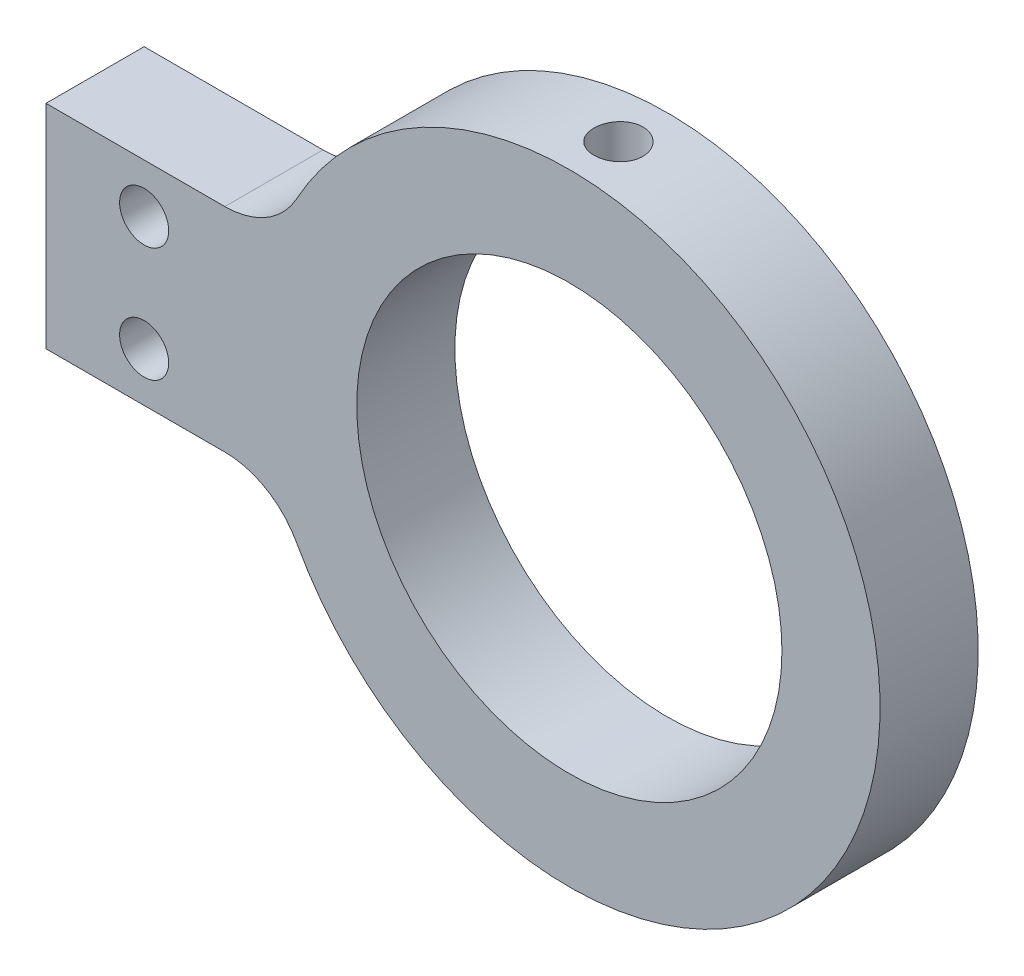
from build123d import *

# Parameters (mm, degrees)
SKETCH1_R               = 13
SKETCH1_R_2             = 1.5
BOSS_EXTRUDE1_DEPTH     = 3
CUT_EXTRUDE1_REACH      = 39.336
CUT_EXTRUDE1_END_RADIUS = 19
SKETCH2_R               = 1.5


with BuildPart() as part:
    # Sketch1 → Boss-Extrude1 (new, symmetric)
    with BuildSketch(Plane.XY):
        with BuildLine():
            Line((-21.065374433, 6.5), (-32, 6.5))
            Line((-32, 6.5), (-32, -6.5))
            Line((-32, -6.5), (-21.065374433, -6.5))
            ThreePointArc((-21.065374433, -6.5), (-18.513822618, -7.20004845), (-16.676754759, -9.104166667))
            ThreePointArc((-16.676754759, -9.104166667), (19, 0), (-16.676754759, 9.104166667))
            ThreePointArc((-16.676754759, 9.104166667), (-18.513822618, 7.20004845), (-21.065374433, 6.5))
        make_face()
        Circle(SKETCH1_R, mode=Mode.SUBTRACT)
        with Locations((-26, 3.5)):
            Circle(SKETCH1_R_2, mode=Mode.SUBTRACT)
        with Locations(Location((-26, -3.5, 0), (0, 0, 180))):
            Circle(SKETCH1_R_2, mode=Mode.SUBTRACT)
    extrude(amount=BOSS_EXTRUDE1_DEPTH, both=True)

    # Cut-Extrude1: up to this cylinder (the profile starts inside it)
    cut_extrude1_end = Plane(origin=(0, 0, 0), z_dir=(0, 0, -1)) * Cylinder(CUT_EXTRUDE1_END_RADIUS, 117.672, mode=Mode.PRIVATE)
    # Sketch2 → Cut-Extrude1 (cut, up to the surface)
    with BuildSketch(Plane(origin=(0, 0, 0), x_dir=(1, 0, 0), z_dir=(0, 1, 0)), mode=Mode.PRIVATE) as cut_extrude1_sk1:
        with Locations(Location((0, 0, 0), (0, 0, 90))):
            Circle(SKETCH2_R)
    cut_extrude1_tool1 = extrude(cut_extrude1_sk1.sketch, amount=CUT_EXTRUDE1_REACH, mode=Mode.PRIVATE) & cut_extrude1_end
    add(cut_extrude1_tool1.solids().sort_by_distance((0, 0, 0))[0], mode=Mode.SUBTRACT)


solid = part.part
